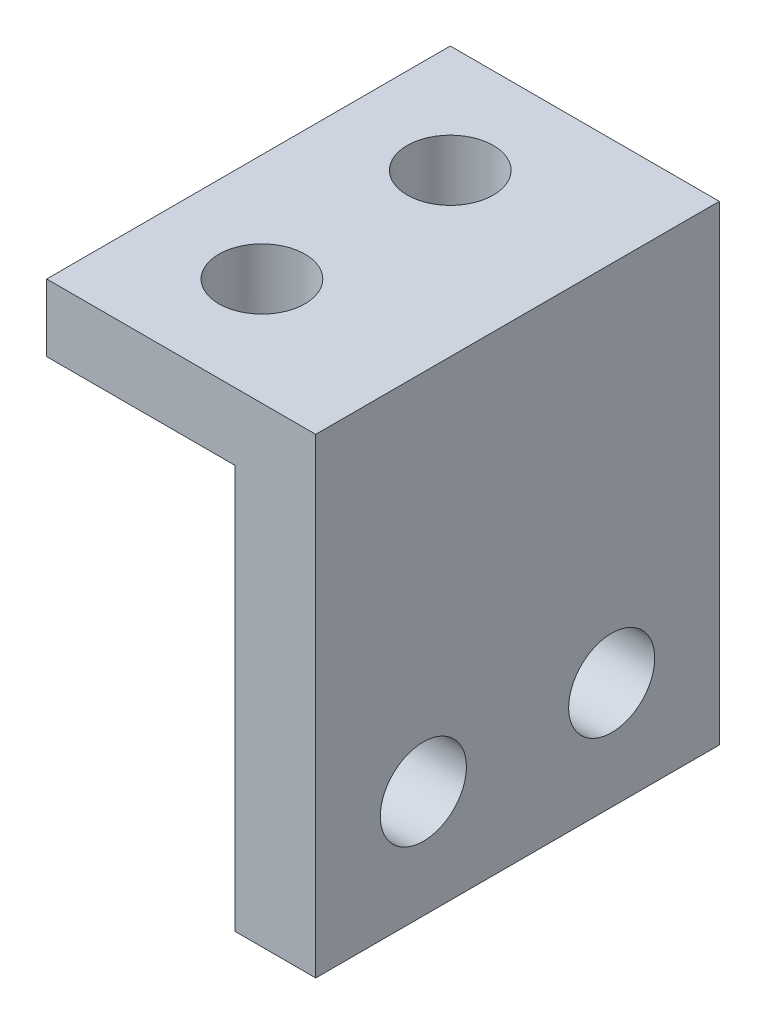
from build123d import *

# Parameters (mm, degrees)
BOSS_EXTRUDE1_DEPTH = 7.5
SKETCH2_R           = 1.6
CUT_EXTRUDE1_DEPTH  = 15
SKETCH3_R           = 1.6
CUT_EXTRUDE2_DEPTH  = 15
SKETCH4_R           = 2.5
CUT_EXTRUDE3_DEPTH  = 15


with BuildPart() as part:
    # Sketch1 → Boss-Extrude1 (new, symmetric)
    with BuildSketch(Plane.XY):
        Polygon((0, 0), (-7, 0), (-7, 2.5), (3, 2.5), (3, -15), (0, -15), align=None)
    extrude(amount=BOSS_EXTRUDE1_DEPTH, both=True)

    # Sketch2 → Cut-Extrude1 (cut)
    with BuildSketch(Plane(origin=(0, 2.5, 0), x_dir=(1, 0, 0), z_dir=(0, 1, 0))):
        with Locations(Location((-3, 3.5, 0), (0, 0, 270))):
            Circle(SKETCH2_R)
        with Locations(Location((-3, -3.5, 0), (0, 0, 270))):
            Circle(SKETCH2_R)
    extrude(amount=-CUT_EXTRUDE1_DEPTH, mode=Mode.SUBTRACT)

    # Sketch3 → Cut-Extrude2 (cut)
    with BuildSketch(Plane(origin=(3, 0, 0), x_dir=(0, 0, -1), z_dir=(1, 0, 0))):
        with Locations(Location((3.5, -11, 0), (0, 0, 90))):
            Circle(SKETCH3_R)
        with Locations(Location((-3.5, -11, 0), (0, 0, 90))):
            Circle(SKETCH3_R)
    extrude(amount=-CUT_EXTRUDE2_DEPTH, mode=Mode.SUBTRACT)

    # Sketch4 → Cut-Extrude3 (cut)
    with BuildSketch(Plane.XZ.offset(15)):
        with Locations((-1.7, 3.5)):
            Circle(SKETCH4_R)
        with Locations((-1.7, -3.5)):
            Circle(SKETCH4_R)
    extrude(amount=-CUT_EXTRUDE3_DEPTH, mode=Mode.SUBTRACT)


solid = part.part
